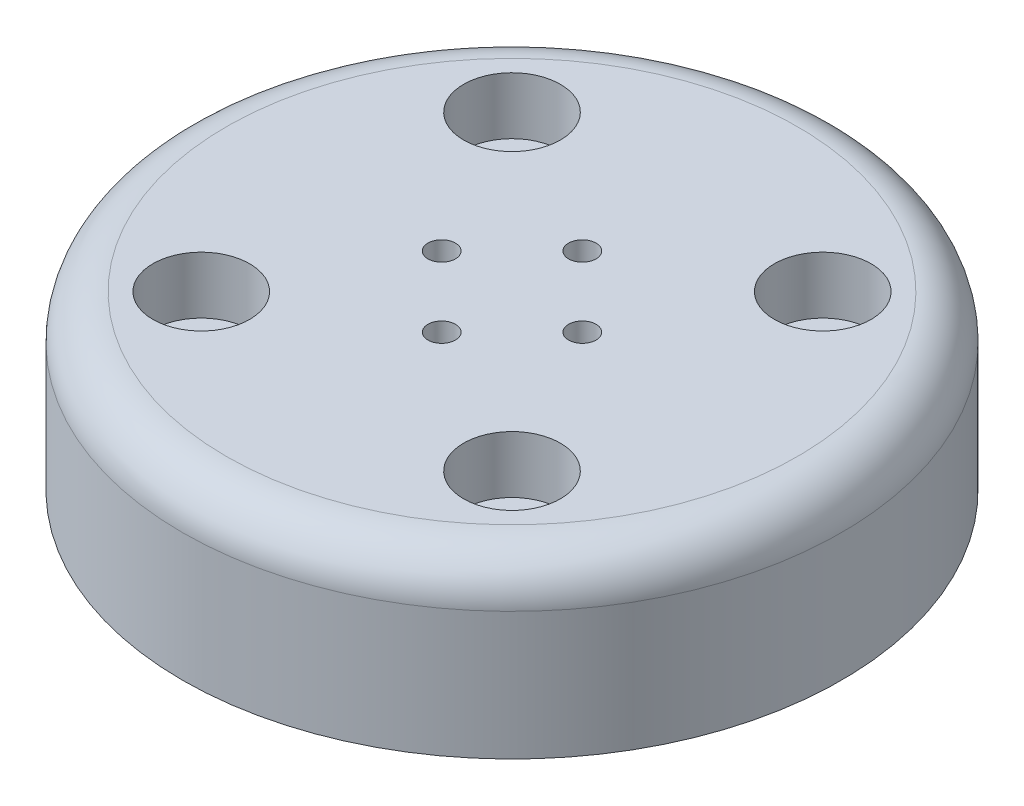
from build123d import *

# Parameters (mm, degrees)
SKETCH1_R           = 37.5
SKETCH1_R_2         = 32
BOSS_EXTRUDE1_DEPTH = 6.7
SKETCH2_R           = 37.5
SKETCH2_R_2         = 3.4
SKETCH2_R_3         = 1.5625
BOSS_EXTRUDE2_DEPTH = 12.85
CUT_EXTRUDE1_START  = -6.5
SKETCH3_R           = 5.5
SKETCH3_R_2         = 3.4
CUT_EXTRUDE1_DEPTH  = 6.5
SKETCH4_R           = 2.5
SKETCH4_R_2         = 1.5625
CUT_EXTRUDE2_DEPTH  = 2.5
FILLET1_R           = 5


with BuildPart() as part:
    # Sketch1 → Boss-Extrude1 (new body)
    with BuildSketch(Plane(origin=(0, 0, 0), x_dir=(1, 0, 0), z_dir=(0, 1, 0))):
        with Locations(Location((0, 0, 0), (0, 0, 270))):
            Circle(SKETCH1_R)
        with Locations(Location((0, 0, 0), (0, 0, 270))):
            Circle(SKETCH1_R_2, mode=Mode.SUBTRACT)
    extrude(amount=BOSS_EXTRUDE1_DEPTH)

    # Sketch2 → Boss-Extrude2 (add)
    with BuildSketch(Plane(origin=(0, 6.7, 0), x_dir=(1, 0, 0), z_dir=(0, 1, 0))):
        with Locations(Location((0, 0, 0), (0, 0, 270))):
            Circle(SKETCH2_R)
        with Locations(Location((-17.68, 17.68, 0), (0, 0, 90))):
            Circle(SKETCH2_R_2, mode=Mode.SUBTRACT)
        with Locations(Location((17.68, 17.68, 0), (0, 0, 90))):
            Circle(SKETCH2_R_2, mode=Mode.SUBTRACT)
        with Locations(Location((17.68, -17.68, 0), (0, 0, 90))):
            Circle(SKETCH2_R_2, mode=Mode.SUBTRACT)
        with Locations(Location((-17.68, -17.68, 0), (0, 0, 90))):
            Circle(SKETCH2_R_2, mode=Mode.SUBTRACT)
        with Locations(Location((0, 8, 0), (0, 0, 90))):
            Circle(SKETCH2_R_3, mode=Mode.SUBTRACT)
        with Locations(Location((8, 0, 0), (0, 0, 90))):
            Circle(SKETCH2_R_3, mode=Mode.SUBTRACT)
        with Locations(Location((-8, 0, 0), (0, 0, 90))):
            Circle(SKETCH2_R_3, mode=Mode.SUBTRACT)
        with Locations(Location((0, -8, 0), (0, 0, 90))):
            Circle(SKETCH2_R_3, mode=Mode.SUBTRACT)
    extrude(amount=BOSS_EXTRUDE2_DEPTH)

    # Sketch3 → Cut-Extrude1 (cut)
    # profile 1 of 4: a face of its own
    with BuildSketch(Plane(origin=(0, 19.55, 0), x_dir=(1, 0, 0), z_dir=(0, 1, 0)).offset(CUT_EXTRUDE1_START)):
        with Locations(Location((-17.68, 17.68, 0), (0, 0, 270))):
            Circle(SKETCH3_R)
        with Locations(Location((-17.68, 17.68, 0), (0, 0, 90))):
            Circle(SKETCH3_R_2, mode=Mode.SUBTRACT)
    # profile 2 of 4: a face of its own
    with BuildSketch(Plane(origin=(0, 19.55, 0), x_dir=(1, 0, 0), z_dir=(0, 1, 0)).offset(CUT_EXTRUDE1_START)):
        with Locations(Location((17.68, 17.68, 0), (0, 0, 270))):
            Circle(SKETCH3_R)
        with Locations(Location((17.68, 17.68, 0), (0, 0, 90))):
            Circle(SKETCH3_R_2, mode=Mode.SUBTRACT)
    # profile 3 of 4: a face of its own
    with BuildSketch(Plane(origin=(0, 19.55, 0), x_dir=(1, 0, 0), z_dir=(0, 1, 0)).offset(CUT_EXTRUDE1_START)):
        with Locations(Location((17.68, -17.68, 0), (0, 0, 270))):
            Circle(SKETCH3_R)
        with Locations(Location((17.68, -17.68, 0), (0, 0, 90))):
            Circle(SKETCH3_R_2, mode=Mode.SUBTRACT)
    # profile 4 of 4: a face of its own
    with BuildSketch(Plane(origin=(0, 19.55, 0), x_dir=(1, 0, 0), z_dir=(0, 1, 0)).offset(CUT_EXTRUDE1_START)):
        with Locations(Location((-17.68, -17.68, 0), (0, 0, 270))):
            Circle(SKETCH3_R)
        with Locations(Location((-17.68, -17.68, 0), (0, 0, 90))):
            Circle(SKETCH3_R_2, mode=Mode.SUBTRACT)
    extrude(amount=CUT_EXTRUDE1_DEPTH, mode=Mode.SUBTRACT)

    # Sketch4 → Cut-Extrude2 (cut)
    # profile 1 of 4: a face of its own
    with BuildSketch(Plane.XZ.offset(-6.7)):
        with Locations(Location((0, 8, 0), (0, 0, 270))):
            Circle(SKETCH4_R)
        with Locations(Location((0, 8, 0), (0, 0, 270))):
            Circle(SKETCH4_R_2, mode=Mode.SUBTRACT)
    # profile 2 of 4: a face of its own
    with BuildSketch(Plane.XZ.offset(-6.7)):
        with Locations(Location((8, 0, 0), (0, 0, 270))):
            Circle(SKETCH4_R)
        with Locations(Location((8, 0, 0), (0, 0, 270))):
            Circle(SKETCH4_R_2, mode=Mode.SUBTRACT)
    # profile 3 of 4: a face of its own
    with BuildSketch(Plane.XZ.offset(-6.7)):
        with Locations(Location((0, -8, 0), (0, 0, 270))):
            Circle(SKETCH4_R)
        with Locations(Location((0, -8, 0), (0, 0, 270))):
            Circle(SKETCH4_R_2, mode=Mode.SUBTRACT)
    # profile 4 of 4: a face of its own
    with BuildSketch(Plane.XZ.offset(-6.7)):
        with Locations(Location((-8, 0, 0), (0, 0, 270))):
            Circle(SKETCH4_R)
        with Locations(Location((-8, 0, 0), (0, 0, 270))):
            Circle(SKETCH4_R_2, mode=Mode.SUBTRACT)
    extrude(amount=-CUT_EXTRUDE2_DEPTH, mode=Mode.SUBTRACT)

    # Fillet1
    fillet1_edges = [part.edges().sort_by_distance(p)[0] for p in [
        (0, 19.55, -37.5),
    ]]
    fillet(fillet1_edges, radius=FILLET1_R)


solid = part.part
